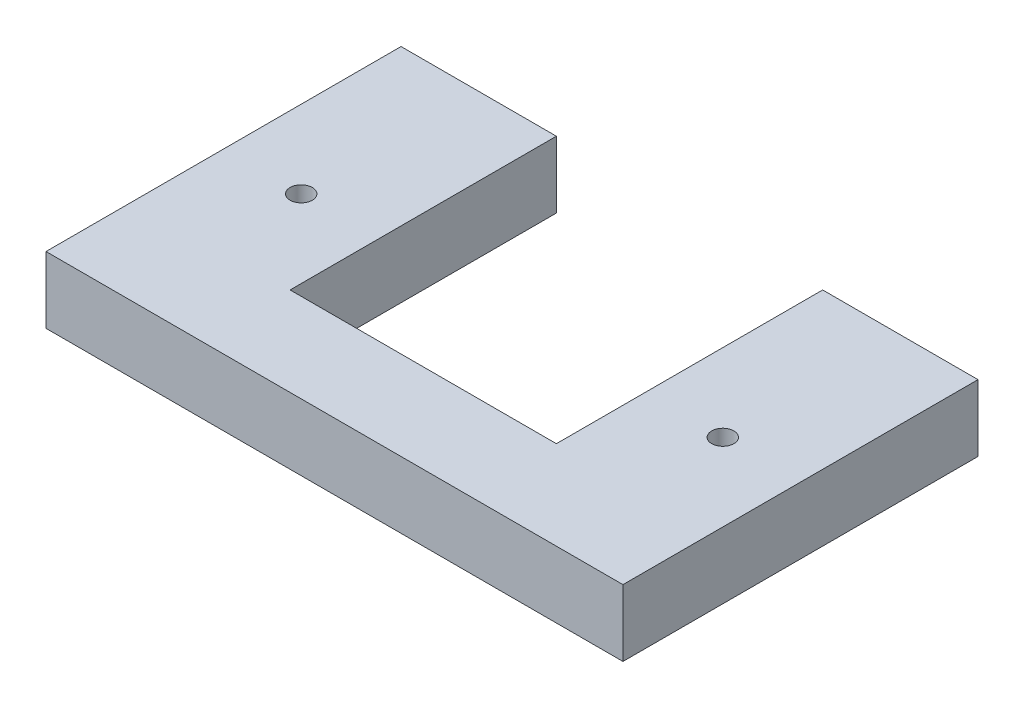
from build123d import *

# Parameters (mm, degrees)
SKETCH1_W           = 165.1
SKETCH1_H           = 101.6
BOSS_EXTRUDE1_DEPTH = 19.05
SKETCH2_W           = 76.2
SKETCH2_H           = 76.2
CUT_EXTRUDE1_DEPTH  = 99.782817332
SKETCH3_R           = 3.175
CUT_EXTRUDE2_DEPTH  = 15.875


with BuildPart() as part:
    # Sketch1 → Boss-Extrude1 (new body)
    with BuildSketch(Plane(origin=(0, 0, 0), x_dir=(1, 0, 0), z_dir=(0, 1, 0))):
        Rectangle(SKETCH1_W, SKETCH1_H)
    extrude(amount=BOSS_EXTRUDE1_DEPTH)

    # Sketch2 → Cut-Extrude1 (cut, through all)
    with BuildSketch(Plane(origin=(0, 19.05, 0), x_dir=(1, 0, 0), z_dir=(0, 1, 0))):
        with Locations((0, 12.7)):
            Rectangle(SKETCH2_W, SKETCH2_H)
    extrude(amount=-CUT_EXTRUDE1_DEPTH, mode=Mode.SUBTRACT)

    # Sketch3 → Cut-Extrude2 (cut)
    with BuildSketch(Plane(origin=(0, 19.05, 0), x_dir=(1, 0, 0), z_dir=(0, 1, 0))):
        with Locations(Location((-60.325, 0, 0), (0, 0, 270))):
            Circle(SKETCH3_R)
        with Locations(Location((60.325, 0, 0), (0, 0, 270))):
            Circle(SKETCH3_R)
    extrude(amount=-CUT_EXTRUDE2_DEPTH, mode=Mode.SUBTRACT)


solid = part.part
